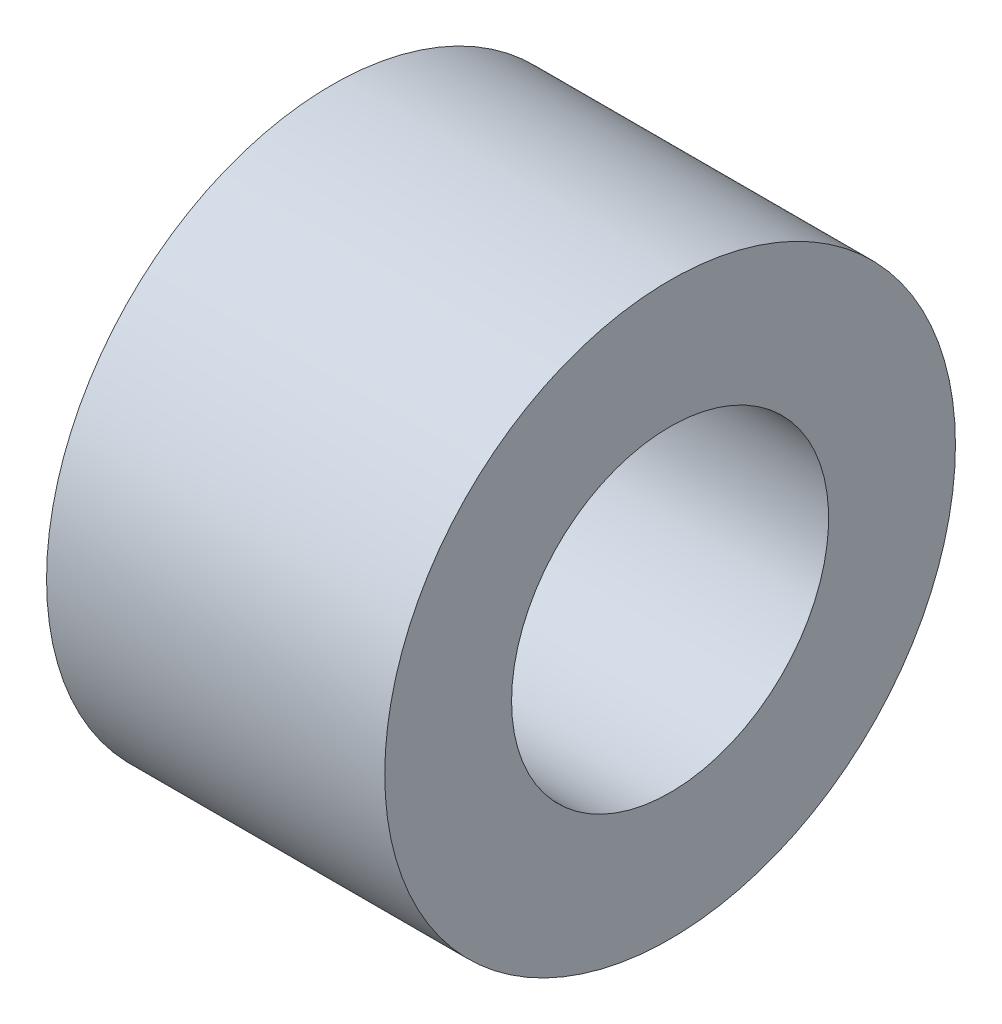
from build123d import *

# Parameters (mm, degrees)
SKETCH_1_W = 80
SKETCH_1_H = 30


with BuildPart() as part:
    # Эскиз1 → Повернуть1 (revolve)
    with BuildSketch(Plane.XY, mode=Mode.PRIVATE) as revolve_1_sk:
        with Locations((40, 52.5)):
            Rectangle(SKETCH_1_W, SKETCH_1_H)
    revolve(revolve_1_sk.sketch.rotate(Axis((0, 0, 0), (1, 0, 0)), 90), axis=Axis((0, 0, 0), (1, 0, 0)))


solid = part.part
